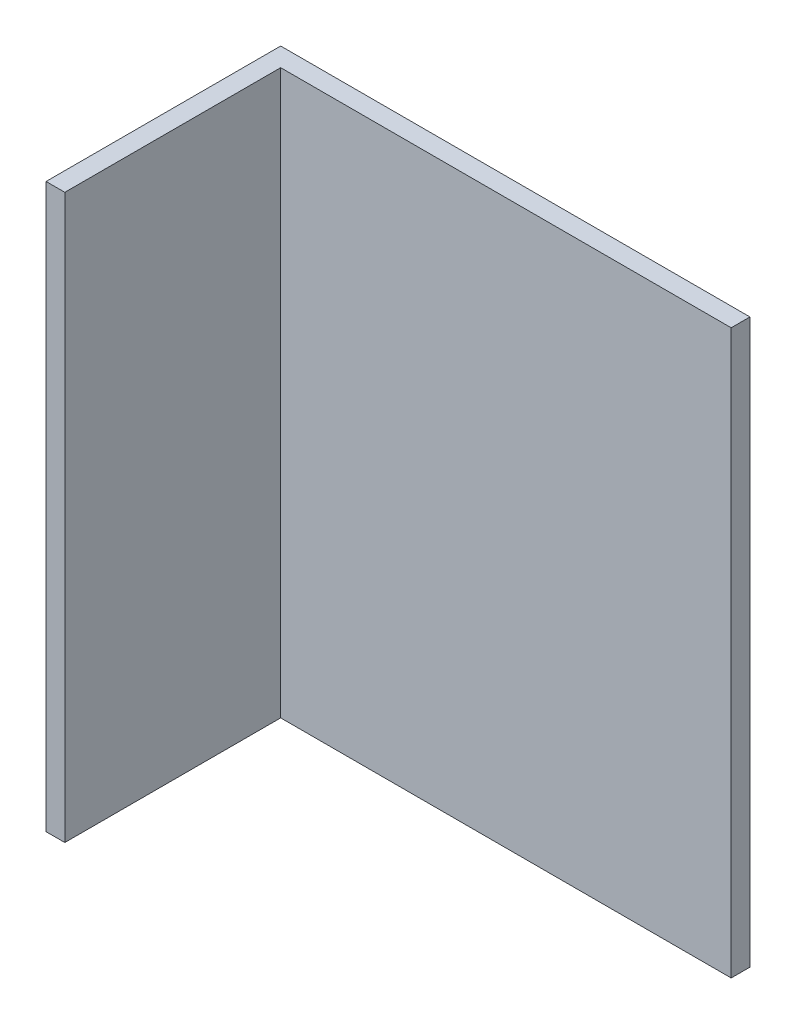
from build123d import *

# Parameters (mm, degrees)
SKETCH_1_W          = 200
SKETCH_1_H          = 240
SKETCH_1_R          = 13
EXTRUDE_393_DEPTH   = 8
SKETCH_2_W          = 8
SKETCH_2_H          = 240
EXTRUDE_1_DEPTH     = 92
SKETCH_3_R          = 13
CUT_EXTRUDE_1_DEPTH = 329.024389337
SKETCH_5_W          = 192
SKETCH_5_H          = 240
EXTRUDE_2_DEPTH     = 8
SKETCH_6_W          = 92
SKETCH_6_H          = 240
EXTRUDE_3_DEPTH     = 8


with BuildPart() as part:
    # 草图1 → Extrude 393 (new body)
    with BuildSketch(Plane.XY):
        with Locations((100, 120)):
            Rectangle(SKETCH_1_W, SKETCH_1_H)
        with Locations((160, 40)):
            Circle(SKETCH_1_R, mode=Mode.SUBTRACT)
        with Locations((160, 120)):
            Circle(SKETCH_1_R, mode=Mode.SUBTRACT)
        with Locations((160, 200)):
            Circle(SKETCH_1_R, mode=Mode.SUBTRACT)
    extrude(amount=EXTRUDE_393_DEPTH)

    # 草图2 → 凸台-拉伸1 (add)
    with BuildSketch(Plane.XY.offset(8)):
        with Locations((4, 120)):
            Rectangle(SKETCH_2_W, SKETCH_2_H)
    extrude(amount=EXTRUDE_1_DEPTH)

    # 草图3 → 切除-拉伸1 (cut, through all)
    with BuildSketch(Plane.ZY):
        with Locations((52, 200)):
            Circle(SKETCH_3_R)
        with Locations((52, 120)):
            Circle(SKETCH_3_R)
        with Locations((52, 40)):
            Circle(SKETCH_3_R)
    extrude(amount=-CUT_EXTRUDE_1_DEPTH, mode=Mode.SUBTRACT)

    # 草图5 → 凸台-拉伸2 (add)
    with BuildSketch(Plane.XY.offset(8)):
        with Locations((104, 120)):
            Rectangle(SKETCH_5_W, SKETCH_5_H)
    extrude(amount=-EXTRUDE_2_DEPTH)

    # 草图6 → 凸台-拉伸3 (add)
    with BuildSketch(Plane(origin=(8, 0, 0), x_dir=(0, 0, -1), z_dir=(1, 0, 0))):
        with Locations((-54, 120)):
            Rectangle(SKETCH_6_W, SKETCH_6_H)
    extrude(amount=-EXTRUDE_3_DEPTH)


solid = part.part
